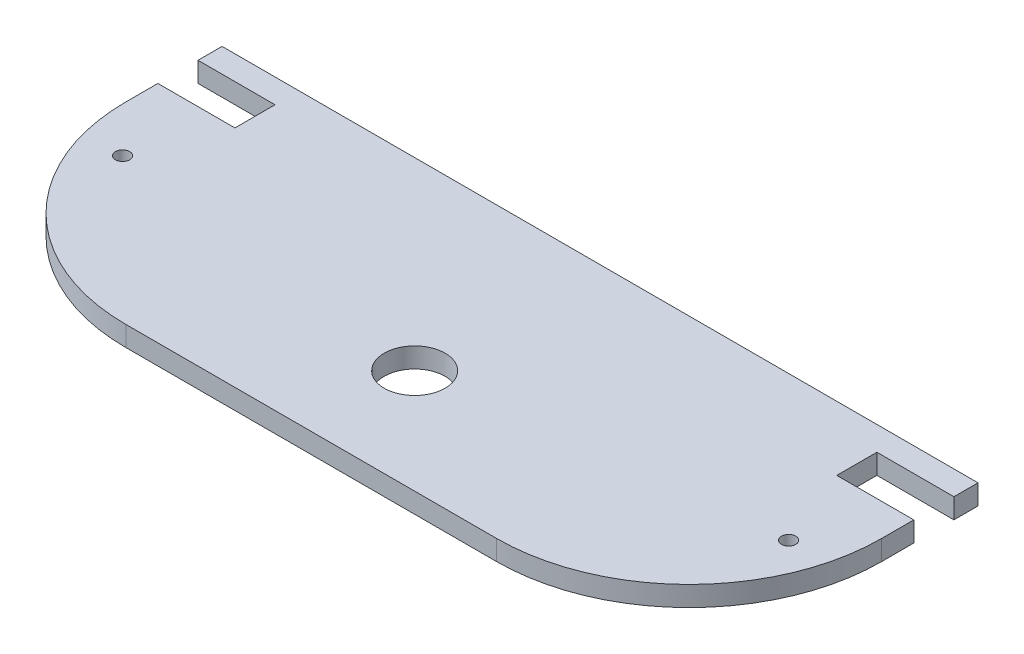
from build123d import *

# Parameters (mm, degrees)
SKETCH1_W           = 119.634
SKETCH1_H           = 41.91
SKETCH1_R           = 4.8133
BOSS_EXTRUDE1_DEPTH = 3.175
SKETCH3_W           = 12.192
SKETCH3_H           = 6.35
CUT_EXTRUDE2_DEPTH  = 22.352
FILLET1_R           = 30.48
SKETCH4_W           = 119.634
SKETCH4_H           = 3.175
BOSS_EXTRUDE2_DEPTH = 3.81
SKETCH5_R           = 1.1303
CUT_EXTRUDE3_DEPTH  = 6.35
SKETCH6_R           = 1.1303
CUT_EXTRUDE4_DEPTH  = 6.35


with BuildPart() as part:
    # Sketch1 → Boss-Extrude1 (new body)
    with BuildSketch(Plane(origin=(0, 0, 0), x_dir=(1, 0, 0), z_dir=(0, 1, 0))):
        with Locations((59.817, 20.955)):
            Rectangle(SKETCH1_W, SKETCH1_H)
        with Locations(Location((59.69, 16.51, 0), (0, 0, 270))):
            Circle(SKETCH1_R, mode=Mode.SUBTRACT)
    extrude(amount=BOSS_EXTRUDE1_DEPTH)

    # Sketch3 → Cut-Extrude2 (cut)
    with BuildSketch(Plane(origin=(0, 3.175, 0), x_dir=(1, 0, 0), z_dir=(0, 1, 0))):
        with Locations((6.096, 38.735)):
            Rectangle(SKETCH3_W, SKETCH3_H)
        with Locations((113.538, 38.735)):
            Rectangle(SKETCH3_W, SKETCH3_H)
    extrude(amount=-CUT_EXTRUDE2_DEPTH, mode=Mode.SUBTRACT)

    # Fillet1
    fillet1_edges = [part.edges().sort_by_distance(p)[0] for p in [
        (119.634, 1.5875, 0),
        (0, 1.5875, 0),
    ]]
    fillet(fillet1_edges, radius=FILLET1_R)

    # Sketch4 → Boss-Extrude2 (add)
    with BuildSketch(Plane(origin=(0, 0, -41.91), x_dir=(-1, 0, 0), z_dir=(0, 0, -1))):
        with Locations((-59.817, 1.5875)):
            Rectangle(SKETCH4_W, SKETCH4_H)
    extrude(amount=BOSS_EXTRUDE2_DEPTH)

    # Sketch5 → Cut-Extrude3 (cut)
    with BuildSketch(Plane.XZ):
        with Locations(Location((7.112, -22.86, 0), (0, 0, 270))):
            Circle(SKETCH5_R)
    extrude(amount=-CUT_EXTRUDE3_DEPTH, mode=Mode.SUBTRACT)

    # Sketch6 → Cut-Extrude4 (cut)
    with BuildSketch(Plane.XZ):
        with Locations(Location((112.522, -22.86, 0), (0, 0, 270))):
            Circle(SKETCH6_R)
    extrude(amount=-CUT_EXTRUDE4_DEPTH, mode=Mode.SUBTRACT)


solid = part.part
